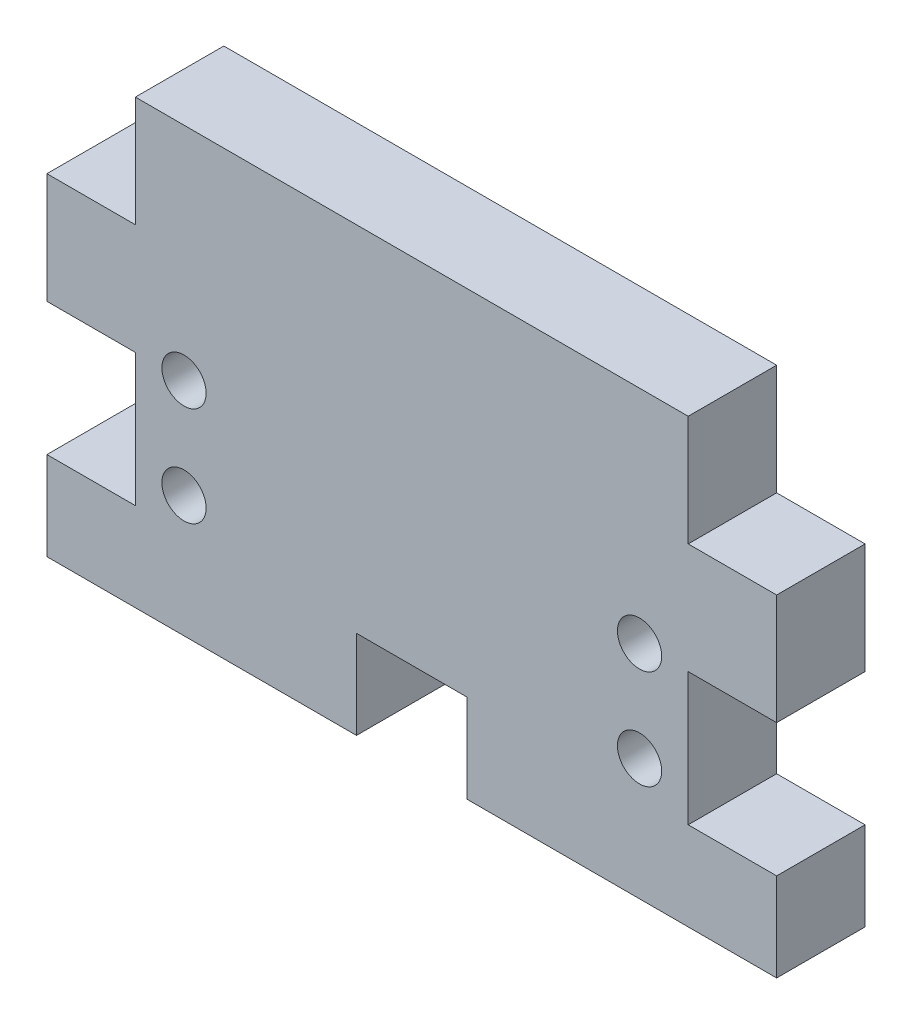
from build123d import *

# Parameters (mm, degrees)
SKETCH_1_W          = 33
SKETCH_1_H          = 20
EXTRUDE_1_DEPTH     = 4
SKETCH_2_W          = 4
SKETCH_2_H          = 5
SKETCH_2_H_2        = 6
SKETCH_2_W_2        = 5
SKETCH_2_H_3        = 4
CUT_EXTRUDE_1_DEPTH = 4
SKETCH_3_R          = 1
CUT_EXTRUDE_2_DEPTH = 4


with BuildPart() as part:
    # Эскиз1 → Бобышка-Вытянуть1 (new body)
    with BuildSketch(Plane.XY):
        with Locations((16.5, 10)):
            Rectangle(SKETCH_1_W, SKETCH_1_H)
    extrude(amount=EXTRUDE_1_DEPTH)

    # Эскиз2 → Вырез-Вытянуть1 (cut)
    with BuildSketch(Plane(origin=(0, 0, 0), x_dir=(-1, 0, 0), z_dir=(0, 0, -1))):
        with Locations((-2, 17.5)):
            Rectangle(SKETCH_2_W, SKETCH_2_H)
        with Locations((-2, 7)):
            Rectangle(SKETCH_2_W, SKETCH_2_H_2)
        with Locations((-16.5, 2)):
            Rectangle(SKETCH_2_W_2, SKETCH_2_H_3)
        with Locations((-31, 7)):
            Rectangle(SKETCH_2_W, SKETCH_2_H_2)
        with Locations((-31, 17.5)):
            Rectangle(SKETCH_2_W, SKETCH_2_H)
    extrude(amount=-CUT_EXTRUDE_1_DEPTH, mode=Mode.SUBTRACT)

    # Эскиз3 → Вырез-Вытянуть2 (cut)
    with BuildSketch(Plane.XY.offset(4)):
        with Locations((6.2, 10)):
            Circle(SKETCH_3_R)
        with Locations(Location((26.8, 10, 0), (0, 0, 180))):
            Circle(SKETCH_3_R)
        with Locations((6.2, 5.5)):
            Circle(SKETCH_3_R)
        with Locations(Location((26.8, 5.5, 0), (0, 0, 180))):
            Circle(SKETCH_3_R)
    extrude(amount=-CUT_EXTRUDE_2_DEPTH, mode=Mode.SUBTRACT)


solid = part.part
